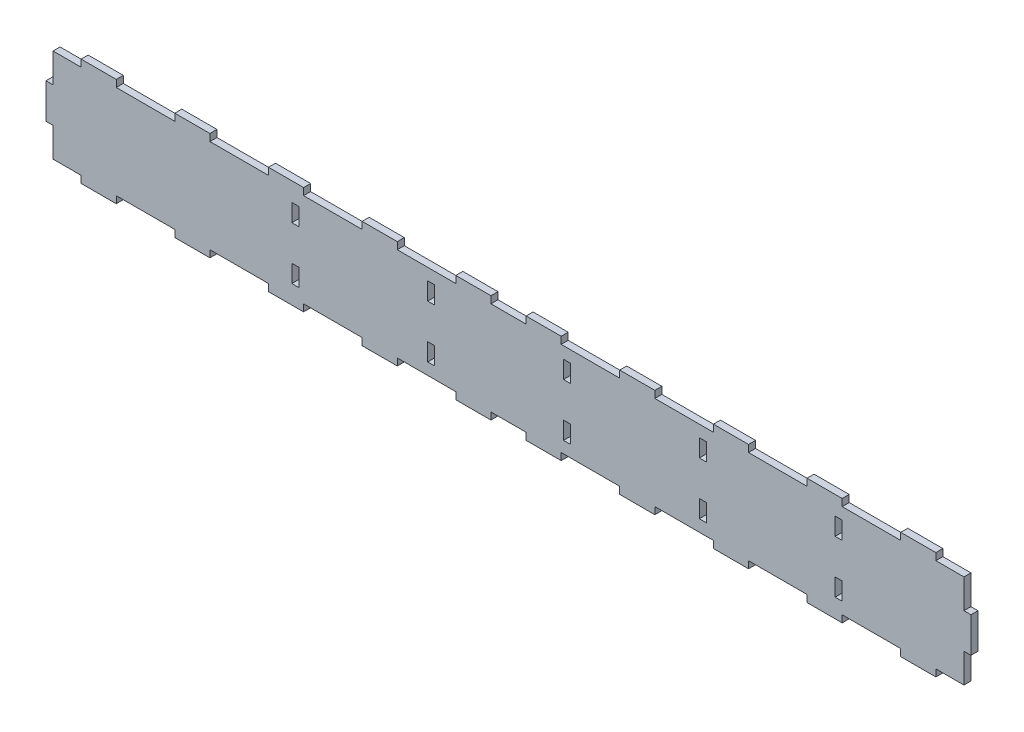
from build123d import *

# Parameters (mm, degrees)
SKETCH1_W           = 790
SKETCH1_H           = 80
BOSS_EXTRUDE1_DEPTH = 6
SKETCH2_W           = 6
SKETCH2_H           = 25
SKETCH2_H_2         = 15
CUT_EXTRUDE1_DEPTH  = 6
SKETCH3_W           = 30
SKETCH3_H           = 6
BOSS_EXTRUDE2_DEPTH = 6


with BuildPart() as part:
    # Sketch1 → Boss-Extrude1 (new body)
    with BuildSketch(Plane.XY):
        Rectangle(SKETCH1_W, SKETCH1_H)
    extrude(amount=BOSS_EXTRUDE1_DEPTH)

    # Sketch2 → Cut-Extrude1 (cut)
    with BuildSketch(Plane(origin=(0, 0, 0), x_dir=(-1, 0, 0), z_dir=(0, 0, -1))):
        with Locations((392, 27.5)):
            Rectangle(SKETCH2_W, SKETCH2_H)
        with Locations((392, -27.5)):
            Rectangle(SKETCH2_W, SKETCH2_H)
        with Locations((-392, -27.5)):
            Rectangle(SKETCH2_W, SKETCH2_H)
        with Locations((-392, 27.5)):
            Rectangle(SKETCH2_W, SKETCH2_H)
        with Locations((66, -22.5)):
            Rectangle(SKETCH2_W, SKETCH2_H_2)
        with Locations((182, -22.5)):
            Rectangle(SKETCH2_W, SKETCH2_H_2)
        with Locations((182, 22.5)):
            Rectangle(SKETCH2_W, SKETCH2_H_2)
        with Locations((66, 22.5)):
            Rectangle(SKETCH2_W, SKETCH2_H_2)
        with Locations((-50, -22.5)):
            Rectangle(SKETCH2_W, SKETCH2_H_2)
        with Locations((-50, 22.5)):
            Rectangle(SKETCH2_W, SKETCH2_H_2)
        with Locations((-166, -22.5)):
            Rectangle(SKETCH2_W, SKETCH2_H_2)
        with Locations((-166, 22.5)):
            Rectangle(SKETCH2_W, SKETCH2_H_2)
        with Locations((-282, -22.5)):
            Rectangle(SKETCH2_W, SKETCH2_H_2)
        with Locations((-282, 22.5)):
            Rectangle(SKETCH2_W, SKETCH2_H_2)
    extrude(amount=-CUT_EXTRUDE1_DEPTH, mode=Mode.SUBTRACT)

    # Sketch3 → Boss-Extrude2 (add)
    with BuildSketch(Plane(origin=(0, 0, 0), x_dir=(-1, 0, 0), z_dir=(0, 0, -1))):
        with Locations((-30, -43)):
            Rectangle(SKETCH3_W, SKETCH3_H)
        with Locations((-30, 43)):
            Rectangle(SKETCH3_W, SKETCH3_H)
        with Locations((-110, -43)):
            Rectangle(SKETCH3_W, SKETCH3_H)
        with Locations((-110, 43)):
            Rectangle(SKETCH3_W, SKETCH3_H)
        with Locations((-190, -43)):
            Rectangle(SKETCH3_W, SKETCH3_H)
        with Locations((-190, 43)):
            Rectangle(SKETCH3_W, SKETCH3_H)
        with Locations((-270, -43)):
            Rectangle(SKETCH3_W, SKETCH3_H)
        with Locations((-270, 43)):
            Rectangle(SKETCH3_W, SKETCH3_H)
        with Locations((-350, -43)):
            Rectangle(SKETCH3_W, SKETCH3_H)
        with Locations((-350, 43)):
            Rectangle(SKETCH3_W, SKETCH3_H)
        with Locations((350, 43)):
            Rectangle(SKETCH3_W, SKETCH3_H)
        with Locations((350, -43)):
            Rectangle(SKETCH3_W, SKETCH3_H)
        with Locations((270, 43)):
            Rectangle(SKETCH3_W, SKETCH3_H)
        with Locations((270, -43)):
            Rectangle(SKETCH3_W, SKETCH3_H)
        with Locations((190, 43)):
            Rectangle(SKETCH3_W, SKETCH3_H)
        with Locations((190, -43)):
            Rectangle(SKETCH3_W, SKETCH3_H)
        with Locations((110, 43)):
            Rectangle(SKETCH3_W, SKETCH3_H)
        with Locations((110, -43)):
            Rectangle(SKETCH3_W, SKETCH3_H)
        with Locations((30, 43)):
            Rectangle(SKETCH3_W, SKETCH3_H)
        with Locations((30, -43)):
            Rectangle(SKETCH3_W, SKETCH3_H)
    extrude(amount=-BOSS_EXTRUDE2_DEPTH)


solid = part.part
